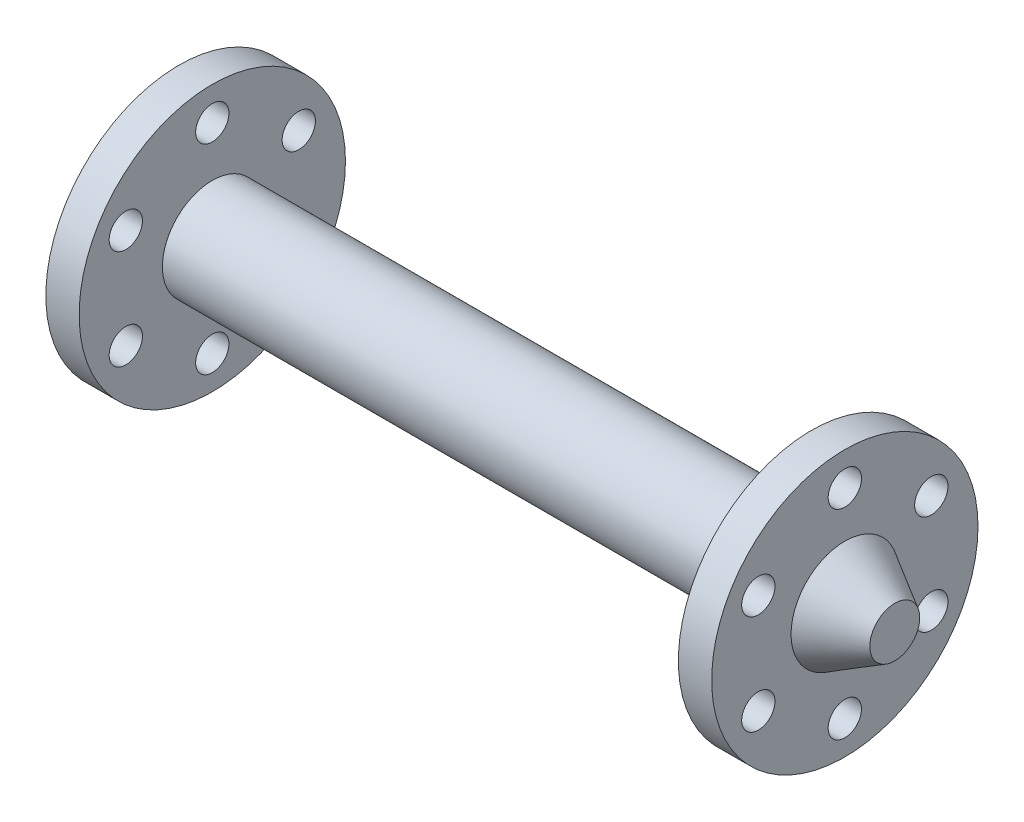
from build123d import *

# Parameters (mm, degrees)
SKETCH3_R           = 80
BOSS_EXTRUDE1_DEPTH = 20
SKETCH4_R           = 10
CUT_EXTRUDE1_DEPTH  = 118.046999107
SKETCH5_R           = 30
BOSS_EXTRUDE2_DEPTH = 360
SKETCH6_R           = 80
BOSS_EXTRUDE3_DEPTH = 20
CUT_EXTRUDE2_START  = -20
SKETCH7_R           = 10
CUT_EXTRUDE2_DEPTH  = 20


with BuildPart() as part:
    # Sketch1 → Revolve1 (revolve)
    with BuildSketch(Plane.XY, mode=Mode.PRIVATE) as revolve1_sk:
        Polygon((0, 0), (0, 15), (30, 32.320508076), (30, 0), align=None)
    revolve(revolve1_sk.sketch.rotate(Axis((-89.090909091, 0, 0), (1, 0, 0)), 90), axis=Axis((-89.090909091, 0, 0), (1, 0, 0)))

    # Sketch3 → Boss-Extrude1 (add)
    with BuildSketch(Plane(origin=(30, 0, 0), x_dir=(0, 0, -1), z_dir=(1, 0, 0))):
        Circle(SKETCH3_R)
    extrude(amount=BOSS_EXTRUDE1_DEPTH)

    # Sketch4 → Cut-Extrude1 (cut, through all)
    with BuildSketch(Plane.ZY.offset(-30)):
        with Locations((0, 60)):
            Circle(SKETCH4_R)
        with Locations((51.961524227, 30)):
            Circle(SKETCH4_R)
        with Locations((51.961524227, -30)):
            Circle(SKETCH4_R)
        with Locations((0, -60)):
            Circle(SKETCH4_R)
        with Locations((-51.961524227, -30)):
            Circle(SKETCH4_R)
        with Locations((-51.961524227, 30)):
            Circle(SKETCH4_R)
    extrude(amount=-CUT_EXTRUDE1_DEPTH, mode=Mode.SUBTRACT)

    # Sketch5 → Boss-Extrude2 (add)
    with BuildSketch(Plane(origin=(50, 0, 0), x_dir=(0, 0, -1), z_dir=(1, 0, 0))):
        Circle(SKETCH5_R)
    extrude(amount=BOSS_EXTRUDE2_DEPTH)

    # Sketch6 → Boss-Extrude3 (add)
    with BuildSketch(Plane(origin=(410, 0, 0), x_dir=(0, 0, -1), z_dir=(1, 0, 0))):
        Circle(SKETCH6_R)
    extrude(amount=BOSS_EXTRUDE3_DEPTH)

    # Sketch7 → Cut-Extrude2 (cut)
    with BuildSketch(Plane(origin=(430, 0, 0), x_dir=(0, 0, -1), z_dir=(1, 0, 0)).offset(CUT_EXTRUDE2_START)):
        with Locations(Location((0, 60, 0), (0, 0, 180))):
            Circle(SKETCH7_R)
        with Locations(Location((51.961524227, 30, 0), (0, 0, 180))):
            Circle(SKETCH7_R)
        with Locations(Location((51.961524227, -30, 0), (0, 0, 180))):
            Circle(SKETCH7_R)
        with Locations(Location((0, -60, 0), (0, 0, 180))):
            Circle(SKETCH7_R)
        with Locations(Location((-51.961524227, -30, 0), (0, 0, 180))):
            Circle(SKETCH7_R)
        with Locations(Location((-51.961524227, 30, 0), (0, 0, 180))):
            Circle(SKETCH7_R)
    extrude(amount=CUT_EXTRUDE2_DEPTH, mode=Mode.SUBTRACT)

    # Sketch9 → Revolve2 (revolve)
    with BuildSketch(Plane(origin=(0, 0, 0), x_dir=(1, 0, 0), z_dir=(0, 1, 0)), mode=Mode.PRIVATE) as revolve2_sk:
        Polygon((460, 15), (460, 0), (430, 0), (430, 32.320508076), align=None)
    revolve(revolve2_sk.sketch.rotate(Axis((-124.815980565, 0, 0), (1, 0, 0)), 180), axis=Axis((-124.815980565, 0, 0), (1, 0, 0)))


solid = part.part
